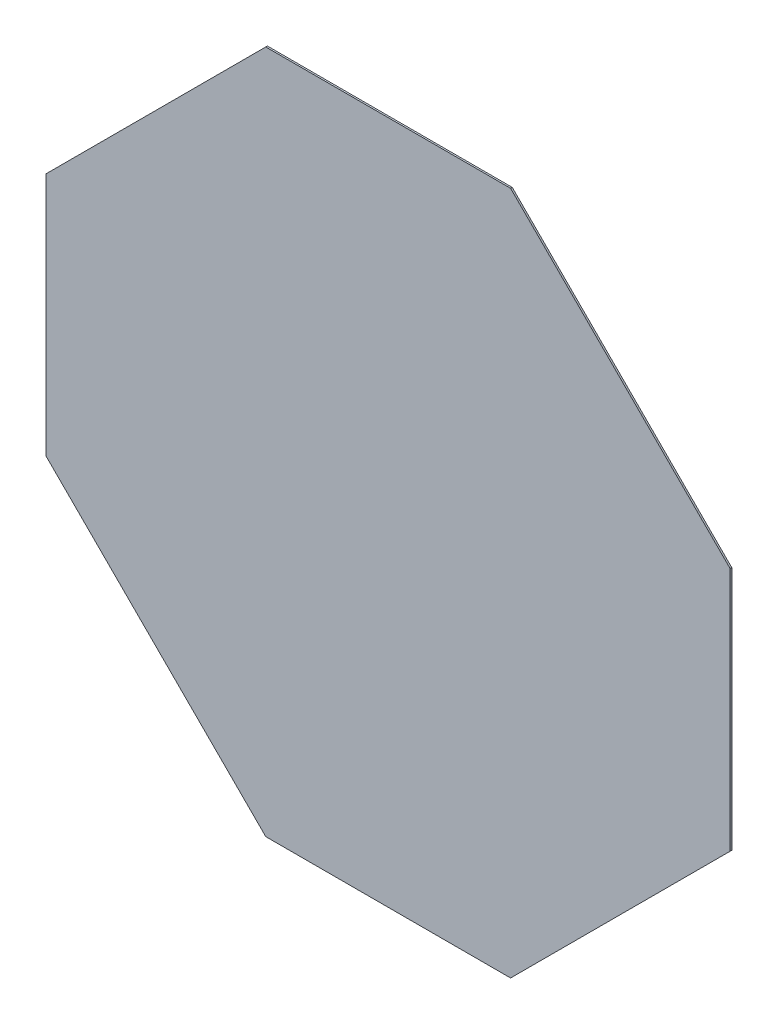
from build123d import *

# Parameters (mm, degrees)
BOSS_EXTRUDE1_DEPTH = 1.2


with BuildPart() as part:
    # Sketch1 → Boss-Extrude1 (new body)
    with BuildSketch(Plane.XY):
        Polygon((9.5, 249.999097194), (169.999097194, 89.5), (169.999097194, -89.5), (9.5, -249.999097194), (-169.5, -249.999097194), (-329.999097194, -89.5), (-329.999097194, 89.5), (-169.5, 249.999097194), align=None)
    extrude(amount=BOSS_EXTRUDE1_DEPTH)


solid = part.part
